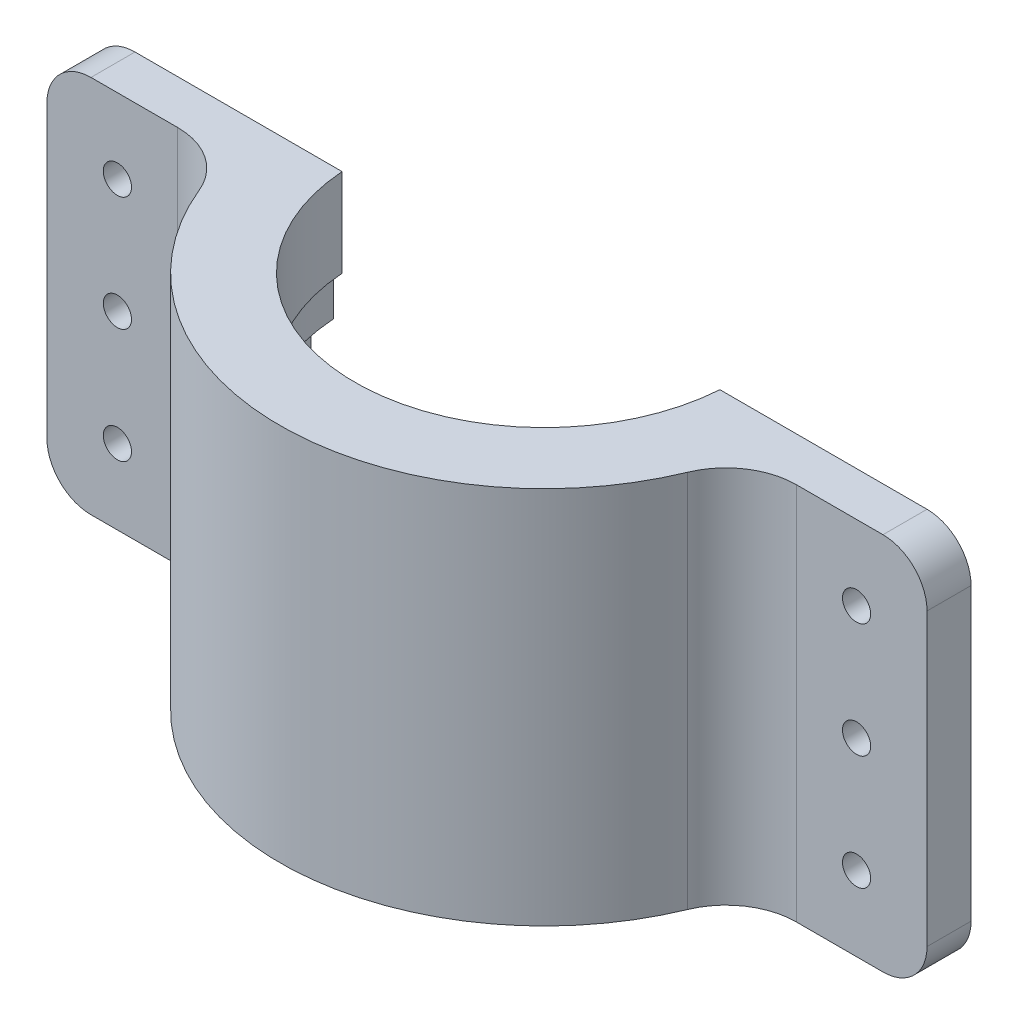
from build123d import *

# Parameters (mm, degrees)
REVOLVE_1_ANGLE     = 180
SKETCH_2_W          = 82.604360497
SKETCH_2_H          = 69.359352877
CUT_EXTRUDE_1_DEPTH = 1.5
SKETCH_3_R          = 1.6
SKETCH_3_W          = 3
SKETCH_3_H          = 43
EXTRUDE_1_DEPTH     = 5
FILLET_1_R          = 8


with BuildPart() as part:
    # 草图1 → 旋转1 (revolve)
    with BuildSketch(Plane.XY):
        Polygon((22.5, 29.467251478), (21.5, 29.467251478), (21.5, 39.467251478), (30, 39.467251478), (30, -3.532748522), (21.5, -3.532748522), (21.5, 4.467251478), (22.5, 4.467251478), (22.5, 9.467251478), (25, 9.467251478), (25, 14.467251478), (22.5, 14.467251478), (22.5, 19.467251478), (25, 19.467251478), (25, 24.467251478), (22.5, 24.467251478), align=None)
    revolve(axis=Axis((0, 80.879290808, 0), (0, -1, 0)), revolution_arc=REVOLVE_1_ANGLE)

    # 草图2 → 切除-拉伸1 (cut)
    with BuildSketch(Plane(origin=(0, 0, 0), x_dir=(-1, 0, 0), z_dir=(0, 0, -1))):
        with Locations((1.112176212, 17.562823765)):
            Rectangle(SKETCH_2_W, SKETCH_2_H)
    extrude(amount=-CUT_EXTRUDE_1_DEPTH, mode=Mode.SUBTRACT)

    # 草图3 → 凸台-拉伸1 (add)
    # profile 1 of 3: a face of its own
    with BuildSketch(Plane(origin=(0, 0, 1.5), x_dir=(-1, 0, 0), z_dir=(0, 0, -1))):
        with BuildLine():
            ThreePointArc((49.962476533, 1.467251478), (48.498010439, -2.068282428), (44.962476533, -3.532748522))
            Line((44.962476533, -3.532748522), (29.962476533, -3.532748522))
            Line((29.962476533, -3.532748522), (29.962476533, 39.467251478))
            Line((29.962476533, 39.467251478), (44.962476533, 39.467251478))
            ThreePointArc((44.962476533, 39.467251478), (48.498010439, 38.002785384), (49.962476533, 34.467251478))
            Line((49.962476533, 34.467251478), (49.962476533, 1.467251478))
        make_face()
        with Locations((41.962476533, 17.967251478)):
            Circle(SKETCH_3_R, mode=Mode.SUBTRACT)
        with Locations((41.962476533, 4.967251478)):
            Circle(SKETCH_3_R, mode=Mode.SUBTRACT)
        with Locations((41.962476533, 30.967251478)):
            Circle(SKETCH_3_R, mode=Mode.SUBTRACT)
    # profile 2 of 3: a face of its own
    with BuildSketch(Plane(origin=(0, 0, 1.5), x_dir=(-1, 0, 0), z_dir=(0, 0, -1))):
        with Locations((28.462476533, 17.967251478)):
            Rectangle(SKETCH_3_W, SKETCH_3_H)
    # profile 3 of 3: a face of its own
    with BuildSketch(Plane(origin=(0, 0, 1.5), x_dir=(-1, 0, 0), z_dir=(0, 0, -1))):
        with BuildLine():
            Line((-29.962476533, 39.467251478), (-44.962476533, 39.467251478))
            ThreePointArc((-44.962476533, 39.467251478), (-48.498010439, 38.002785384), (-49.962476533, 34.467251478))
            Line((-49.962476533, 34.467251478), (-49.962476533, 1.467251478))
            ThreePointArc((-49.962476533, 1.467251478), (-48.498010439, -2.068282428), (-44.962476533, -3.532748522))
            Line((-44.962476533, -3.532748522), (-29.962476533, -3.532748522))
            Line((-29.962476533, -3.532748522), (-26.962476533, -3.532748522))
            Line((-26.962476533, -3.532748522), (-26.962476533, 39.467251478))
            Line((-26.962476533, 39.467251478), (-29.962476533, 39.467251478))
        make_face()
        with Locations((-41.962476533, 30.967251478)):
            Circle(SKETCH_3_R, mode=Mode.SUBTRACT)
        with Locations((-41.962476533, 17.967251478)):
            Circle(SKETCH_3_R, mode=Mode.SUBTRACT)
        with Locations((-41.962476533, 4.967251478)):
            Circle(SKETCH_3_R, mode=Mode.SUBTRACT)
    extrude(amount=-EXTRUDE_1_DEPTH)

    # 圆角1
    fillet_1_edges = [part.edges().sort_by_distance(p)[0] for p in [
        (-29.287369291, 17.967251478, 6.5),
        (29.287369291, 17.967251478, 6.5),
    ]]
    fillet(fillet_1_edges, radius=FILLET_1_R)


solid = part.part
